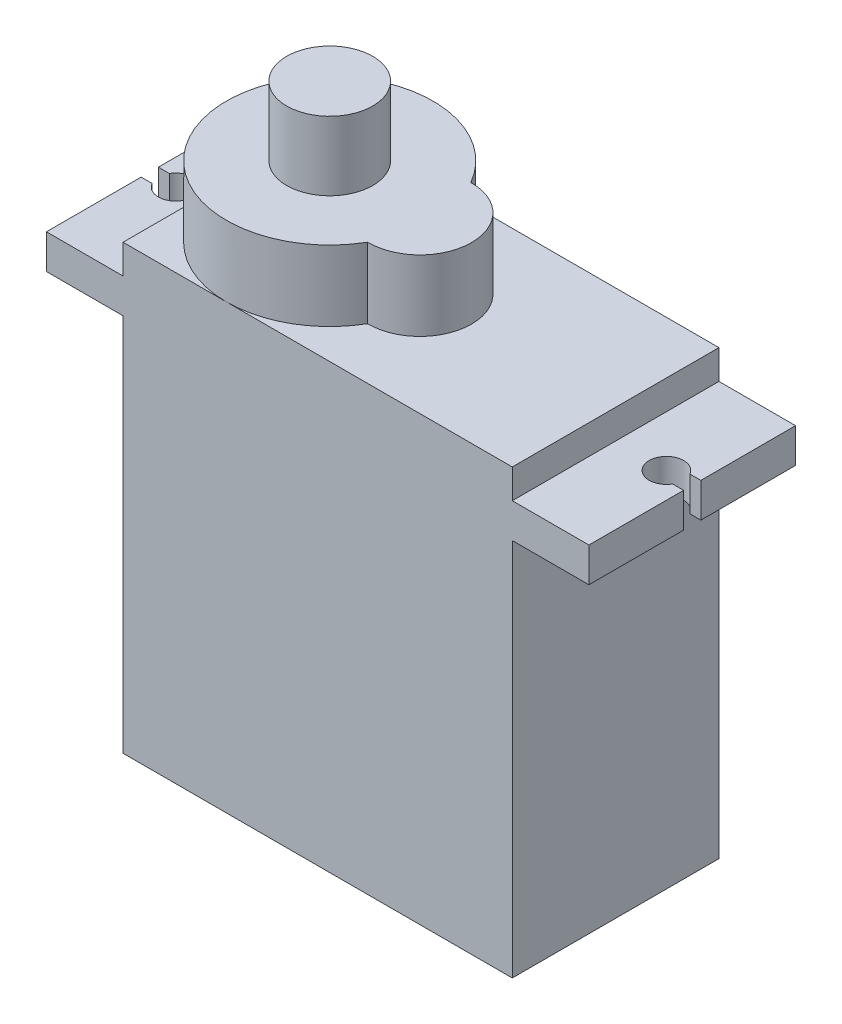
from build123d import *

# Parameters (mm, degrees)
SCHIZZO1_W                   = 22.6
SCHIZZO1_H                   = 12
ESTRUSIONE_ESTRUSIONE1_DEPTH = 22
SCHIZZO3_W                   = 31.5
SCHIZZO3_H                   = 12
ESTRUSIONE_ESTRUSIONE2_DEPTH = 2
SCHIZZO4_W                   = 22.6
SCHIZZO4_H                   = 12
ESTRUSIONE_ESTRUSIONE3_DEPTH = 1.7
SCHIZZO5_R                   = 3
SCHIZZO5_R_2                 = 6
ESTRUSIONE_ESTRUSIONE4_DEPTH = 4.1
SCHIZZO6_R                   = 2.5
ESTRUSIONE_ESTRUSIONE5_DEPTH = 4
TAGLIO_ESTRUSIONE2_REACH     = 40.101


with BuildPart() as part:
    # Schizzo1 → Estrusione-Estrusione1 (new body)
    with BuildSketch(Plane(origin=(0, 0, 0), x_dir=(1, 0, 0), z_dir=(0, 1, 0))):
        with Locations((11.3, 6)):
            Rectangle(SCHIZZO1_W, SCHIZZO1_H)
    extrude(amount=ESTRUSIONE_ESTRUSIONE1_DEPTH)

    # Schizzo3 → Estrusione-Estrusione2 (add)
    with BuildSketch(Plane(origin=(0, 22, 0), x_dir=(1, 0, 0), z_dir=(0, 1, 0))):
        with Locations((11.3, 6)):
            Rectangle(SCHIZZO3_W, SCHIZZO3_H)
    extrude(amount=ESTRUSIONE_ESTRUSIONE2_DEPTH)

    # Schizzo4 → Estrusione-Estrusione3 (add)
    with BuildSketch(Plane(origin=(0, 24, 0), x_dir=(1, 0, 0), z_dir=(0, 1, 0))):
        with Locations((11.3, 6)):
            Rectangle(SCHIZZO4_W, SCHIZZO4_H)
    extrude(amount=ESTRUSIONE_ESTRUSIONE3_DEPTH)

    # Schizzo5 → Estrusione-Estrusione4 (add)
    with BuildSketch(Plane(origin=(0, 25.7, 0), x_dir=(1, 0, 0), z_dir=(0, 1, 0))):
        with Locations((11.236395356, 6)):
            Circle(SCHIZZO5_R)
        with Locations((6, 6)):
            Circle(SCHIZZO5_R_2)
    extrude(amount=ESTRUSIONE_ESTRUSIONE4_DEPTH)

    # Schizzo6 → Estrusione-Estrusione5 (add)
    with BuildSketch(Plane(origin=(0, 29.8, 0), x_dir=(1, 0, 0), z_dir=(0, 1, 0))):
        with Locations(Location((6, 6, 0), (0, 0, 270))):
            Circle(SCHIZZO6_R)
    extrude(amount=ESTRUSIONE_ESTRUSIONE5_DEPTH)

    # Schizzo7 → Taglio-Estrusione2 (cut, up to next)
    with BuildSketch(Plane(origin=(0, 24, 0), x_dir=(1, 0, 0), z_dir=(0, 1, 0)), mode=Mode.PRIVATE) as taglio_estrusione2_sk1:
        with BuildLine():
            Line((-4.45, 5.5), (-3.816025404, 5.5))
            ThreePointArc((-3.816025404, 5.5), (-3.915925826, 5.741180955), (-3.95, 6))
            Line((-3.95, 6), (-4.45, 6))
            Line((-4.45, 6), (-4.45, 5.5))
        make_face()
    taglio_estrusione2_tool1 = extrude(taglio_estrusione2_sk1.sketch, amount=-TAGLIO_ESTRUSIONE2_REACH, mode=Mode.PRIVATE) & part.part
    # Schizzo7 → Taglio-Estrusione2 (cut, up to next)
    with BuildSketch(Plane(origin=(0, 24, 0), x_dir=(1, 0, 0), z_dir=(0, 1, 0)), mode=Mode.PRIVATE) as taglio_estrusione2_sk2:
        with BuildLine():
            ThreePointArc((-3.95, 6), (-3.915925826, 6.258819045), (-3.816025404, 6.5))
            Line((-3.816025404, 6.5), (-4.45, 6.5))
            Line((-4.45, 6.5), (-4.45, 6))
            Line((-4.45, 6), (-3.95, 6))
        make_face()
    taglio_estrusione2_tool2 = extrude(taglio_estrusione2_sk2.sketch, amount=-TAGLIO_ESTRUSIONE2_REACH, mode=Mode.PRIVATE) & part.part
    # Schizzo7 → Taglio-Estrusione2 (cut, up to next)
    with BuildSketch(Plane(origin=(0, 24, 0), x_dir=(1, 0, 0), z_dir=(0, 1, 0)), mode=Mode.PRIVATE) as taglio_estrusione2_sk3:
        with BuildLine():
            ThreePointArc((-3.816025404, 5.5), (-2.691180955, 5.034074174), (-1.95, 6))
            Line((-1.95, 6), (-2.449082486, 6))
            Line((-2.449082486, 6), (-2.449082486, 5.5))
            Line((-2.449082486, 5.5), (-3.816025404, 5.5))
        make_face()
    taglio_estrusione2_tool3 = extrude(taglio_estrusione2_sk3.sketch, amount=-TAGLIO_ESTRUSIONE2_REACH, mode=Mode.PRIVATE) & part.part
    # Schizzo7 → Taglio-Estrusione2 (cut, up to next)
    with BuildSketch(Plane(origin=(0, 24, 0), x_dir=(1, 0, 0), z_dir=(0, 1, 0)), mode=Mode.PRIVATE) as taglio_estrusione2_sk4:
        with BuildLine():
            Line((-2.449082486, 5.5), (-2.449082486, 6))
            Line((-2.449082486, 6), (-3.95, 6))
            ThreePointArc((-3.95, 6), (-3.915925826, 5.741180955), (-3.816025404, 5.5))
            Line((-3.816025404, 5.5), (-2.449082486, 5.5))
        make_face()
    taglio_estrusione2_tool4 = extrude(taglio_estrusione2_sk4.sketch, amount=-TAGLIO_ESTRUSIONE2_REACH, mode=Mode.PRIVATE) & part.part
    # Schizzo7 → Taglio-Estrusione2 (cut, up to next)
    with BuildSketch(Plane(origin=(0, 24, 0), x_dir=(1, 0, 0), z_dir=(0, 1, 0)), mode=Mode.PRIVATE) as taglio_estrusione2_sk5:
        with BuildLine():
            Line((-2.449082486, 6), (-1.95, 6))
            ThreePointArc((-1.95, 6), (-2.691180955, 6.965925826), (-3.816025404, 6.5))
            Line((-3.816025404, 6.5), (-2.449082486, 6.5))
            Line((-2.449082486, 6.5), (-2.449082486, 6))
        make_face()
    taglio_estrusione2_tool5 = extrude(taglio_estrusione2_sk5.sketch, amount=-TAGLIO_ESTRUSIONE2_REACH, mode=Mode.PRIVATE) & part.part
    # Schizzo7 → Taglio-Estrusione2 (cut, up to next)
    with BuildSketch(Plane(origin=(0, 24, 0), x_dir=(1, 0, 0), z_dir=(0, 1, 0)), mode=Mode.PRIVATE) as taglio_estrusione2_sk6:
        with BuildLine():
            Line((-3.95, 6), (-2.449082486, 6))
            Line((-2.449082486, 6), (-2.449082486, 6.5))
            Line((-2.449082486, 6.5), (-3.816025404, 6.5))
            ThreePointArc((-3.816025404, 6.5), (-3.915925826, 6.258819045), (-3.95, 6))
        make_face()
    taglio_estrusione2_tool6 = extrude(taglio_estrusione2_sk6.sketch, amount=-TAGLIO_ESTRUSIONE2_REACH, mode=Mode.PRIVATE) & part.part
    # Schizzo7 → Taglio-Estrusione2 (cut, up to next)
    with BuildSketch(Plane(origin=(0, 24, 0), x_dir=(1, 0, 0), z_dir=(0, 1, 0)), mode=Mode.PRIVATE) as taglio_estrusione2_sk7:
        with BuildLine():
            ThreePointArc((-3.816025404, 5.5), (-2.691180955, 5.034074174), (-1.95, 6))
            Line((-1.95, 6), (-2.449082486, 6))
            Line((-2.449082486, 6), (-2.449082486, 5.5))
            Line((-2.449082486, 5.5), (-3.816025404, 5.5))
        make_face()
    taglio_estrusione2_tool7 = extrude(taglio_estrusione2_sk7.sketch, amount=-TAGLIO_ESTRUSIONE2_REACH, mode=Mode.PRIVATE) & part.part
    # Schizzo7 → Taglio-Estrusione2 (cut, up to next)
    with BuildSketch(Plane(origin=(0, 24, 0), x_dir=(1, 0, 0), z_dir=(0, 1, 0)), mode=Mode.PRIVATE) as taglio_estrusione2_sk8:
        with BuildLine():
            Line((-2.449082486, 5.5), (-2.449082486, 6))
            Line((-2.449082486, 6), (-3.95, 6))
            ThreePointArc((-3.95, 6), (-3.915925826, 5.741180955), (-3.816025404, 5.5))
            Line((-3.816025404, 5.5), (-2.449082486, 5.5))
        make_face()
    taglio_estrusione2_tool8 = extrude(taglio_estrusione2_sk8.sketch, amount=-TAGLIO_ESTRUSIONE2_REACH, mode=Mode.PRIVATE) & part.part
    # Schizzo7 → Taglio-Estrusione2 (cut, up to next)
    with BuildSketch(Plane(origin=(0, 24, 0), x_dir=(1, 0, 0), z_dir=(0, 1, 0)), mode=Mode.PRIVATE) as taglio_estrusione2_sk9:
        with BuildLine():
            Line((-2.449082486, 6), (-1.95, 6))
            ThreePointArc((-1.95, 6), (-2.691180955, 6.965925826), (-3.816025404, 6.5))
            Line((-3.816025404, 6.5), (-2.449082486, 6.5))
            Line((-2.449082486, 6.5), (-2.449082486, 6))
        make_face()
    taglio_estrusione2_tool9 = extrude(taglio_estrusione2_sk9.sketch, amount=-TAGLIO_ESTRUSIONE2_REACH, mode=Mode.PRIVATE) & part.part
    # Schizzo7 → Taglio-Estrusione2 (cut, up to next)
    with BuildSketch(Plane(origin=(0, 24, 0), x_dir=(1, 0, 0), z_dir=(0, 1, 0)), mode=Mode.PRIVATE) as taglio_estrusione2_sk10:
        with BuildLine():
            Line((-3.95, 6), (-2.449082486, 6))
            Line((-2.449082486, 6), (-2.449082486, 6.5))
            Line((-2.449082486, 6.5), (-3.816025404, 6.5))
            ThreePointArc((-3.816025404, 6.5), (-3.915925826, 6.258819045), (-3.95, 6))
        make_face()
    taglio_estrusione2_tool10 = extrude(taglio_estrusione2_sk10.sketch, amount=-TAGLIO_ESTRUSIONE2_REACH, mode=Mode.PRIVATE) & part.part
    # Schizzo7 → Taglio-Estrusione2 (cut, up to next)
    with BuildSketch(Plane(origin=(0, 24, 0), x_dir=(1, 0, 0), z_dir=(0, 1, 0)), mode=Mode.PRIVATE) as taglio_estrusione2_sk11:
        with BuildLine():
            ThreePointArc((26.416025404, 5.5), (26.515925826, 5.741180955), (26.55, 6))
            Line((26.55, 6), (25.047557224, 6))
            Line((25.047557224, 6), (25.047557224, 5.5))
            Line((25.047557224, 5.5), (26.416025404, 5.5))
        make_face()
    taglio_estrusione2_tool11 = extrude(taglio_estrusione2_sk11.sketch, amount=-TAGLIO_ESTRUSIONE2_REACH, mode=Mode.PRIVATE) & part.part
    # Schizzo7 → Taglio-Estrusione2 (cut, up to next)
    with BuildSketch(Plane(origin=(0, 24, 0), x_dir=(1, 0, 0), z_dir=(0, 1, 0)), mode=Mode.PRIVATE) as taglio_estrusione2_sk12:
        with BuildLine():
            Line((25.047557224, 5.5), (25.047557224, 6))
            Line((25.047557224, 6), (24.55, 6))
            ThreePointArc((24.55, 6), (25.291180955, 5.034074174), (26.416025404, 5.5))
            Line((26.416025404, 5.5), (25.047557224, 5.5))
        make_face()
    taglio_estrusione2_tool12 = extrude(taglio_estrusione2_sk12.sketch, amount=-TAGLIO_ESTRUSIONE2_REACH, mode=Mode.PRIVATE) & part.part
    # Schizzo7 → Taglio-Estrusione2 (cut, up to next)
    with BuildSketch(Plane(origin=(0, 24, 0), x_dir=(1, 0, 0), z_dir=(0, 1, 0)), mode=Mode.PRIVATE) as taglio_estrusione2_sk13:
        with BuildLine():
            ThreePointArc((26.416025404, 5.5), (26.515925826, 5.741180955), (26.55, 6))
            Line((26.55, 6), (25.047557224, 6))
            Line((25.047557224, 6), (25.047557224, 5.5))
            Line((25.047557224, 5.5), (26.416025404, 5.5))
        make_face()
    taglio_estrusione2_tool13 = extrude(taglio_estrusione2_sk13.sketch, amount=-TAGLIO_ESTRUSIONE2_REACH, mode=Mode.PRIVATE) & part.part
    # Schizzo7 → Taglio-Estrusione2 (cut, up to next)
    with BuildSketch(Plane(origin=(0, 24, 0), x_dir=(1, 0, 0), z_dir=(0, 1, 0)), mode=Mode.PRIVATE) as taglio_estrusione2_sk14:
        with BuildLine():
            Line((25.047557224, 5.5), (25.047557224, 6))
            Line((25.047557224, 6), (24.55, 6))
            ThreePointArc((24.55, 6), (25.291180955, 5.034074174), (26.416025404, 5.5))
            Line((26.416025404, 5.5), (25.047557224, 5.5))
        make_face()
    taglio_estrusione2_tool14 = extrude(taglio_estrusione2_sk14.sketch, amount=-TAGLIO_ESTRUSIONE2_REACH, mode=Mode.PRIVATE) & part.part
    # Schizzo7 → Taglio-Estrusione2 (cut, up to next)
    with BuildSketch(Plane(origin=(0, 24, 0), x_dir=(1, 0, 0), z_dir=(0, 1, 0)), mode=Mode.PRIVATE) as taglio_estrusione2_sk15:
        with BuildLine():
            Line((25.047557224, 6), (26.55, 6))
            ThreePointArc((26.55, 6), (26.515925826, 6.258819045), (26.416025404, 6.5))
            Line((26.416025404, 6.5), (25.047557224, 6.5))
            Line((25.047557224, 6.5), (25.047557224, 6))
        make_face()
    taglio_estrusione2_tool15 = extrude(taglio_estrusione2_sk15.sketch, amount=-TAGLIO_ESTRUSIONE2_REACH, mode=Mode.PRIVATE) & part.part
    # Schizzo7 → Taglio-Estrusione2 (cut, up to next)
    with BuildSketch(Plane(origin=(0, 24, 0), x_dir=(1, 0, 0), z_dir=(0, 1, 0)), mode=Mode.PRIVATE) as taglio_estrusione2_sk16:
        with BuildLine():
            Line((24.55, 6), (25.047557224, 6))
            Line((25.047557224, 6), (25.047557224, 6.5))
            Line((25.047557224, 6.5), (26.416025404, 6.5))
            ThreePointArc((26.416025404, 6.5), (25.291180955, 6.965925826), (24.55, 6))
        make_face()
    taglio_estrusione2_tool16 = extrude(taglio_estrusione2_sk16.sketch, amount=-TAGLIO_ESTRUSIONE2_REACH, mode=Mode.PRIVATE) & part.part
    # Schizzo7 → Taglio-Estrusione2 (cut, up to next)
    with BuildSketch(Plane(origin=(0, 24, 0), x_dir=(1, 0, 0), z_dir=(0, 1, 0)), mode=Mode.PRIVATE) as taglio_estrusione2_sk17:
        with BuildLine():
            Line((25.047557224, 6), (26.55, 6))
            ThreePointArc((26.55, 6), (26.515925826, 6.258819045), (26.416025404, 6.5))
            Line((26.416025404, 6.5), (25.047557224, 6.5))
            Line((25.047557224, 6.5), (25.047557224, 6))
        make_face()
    taglio_estrusione2_tool17 = extrude(taglio_estrusione2_sk17.sketch, amount=-TAGLIO_ESTRUSIONE2_REACH, mode=Mode.PRIVATE) & part.part
    # Schizzo7 → Taglio-Estrusione2 (cut, up to next)
    with BuildSketch(Plane(origin=(0, 24, 0), x_dir=(1, 0, 0), z_dir=(0, 1, 0)), mode=Mode.PRIVATE) as taglio_estrusione2_sk18:
        with BuildLine():
            Line((24.55, 6), (25.047557224, 6))
            Line((25.047557224, 6), (25.047557224, 6.5))
            Line((25.047557224, 6.5), (26.416025404, 6.5))
            ThreePointArc((26.416025404, 6.5), (25.291180955, 6.965925826), (24.55, 6))
        make_face()
    taglio_estrusione2_tool18 = extrude(taglio_estrusione2_sk18.sketch, amount=-TAGLIO_ESTRUSIONE2_REACH, mode=Mode.PRIVATE) & part.part
    # Schizzo7 → Taglio-Estrusione2 (cut, up to next)
    with BuildSketch(Plane(origin=(0, 24, 0), x_dir=(1, 0, 0), z_dir=(0, 1, 0)), mode=Mode.PRIVATE) as taglio_estrusione2_sk19:
        with BuildLine():
            Line((26.55, 6), (27.05, 6))
            Line((27.05, 6), (27.05, 6.5))
            Line((27.05, 6.5), (26.416025404, 6.5))
            ThreePointArc((26.416025404, 6.5), (26.515925826, 6.258819045), (26.55, 6))
        make_face()
    taglio_estrusione2_tool19 = extrude(taglio_estrusione2_sk19.sketch, amount=-TAGLIO_ESTRUSIONE2_REACH, mode=Mode.PRIVATE) & part.part
    # Schizzo7 → Taglio-Estrusione2 (cut, up to next)
    with BuildSketch(Plane(origin=(0, 24, 0), x_dir=(1, 0, 0), z_dir=(0, 1, 0)), mode=Mode.PRIVATE) as taglio_estrusione2_sk20:
        with BuildLine():
            Line((27.05, 5.5), (27.05, 6))
            Line((27.05, 6), (26.55, 6))
            ThreePointArc((26.55, 6), (26.515925826, 5.741180955), (26.416025404, 5.5))
            Line((26.416025404, 5.5), (27.05, 5.5))
        make_face()
    taglio_estrusione2_tool20 = extrude(taglio_estrusione2_sk20.sketch, amount=-TAGLIO_ESTRUSIONE2_REACH, mode=Mode.PRIVATE) & part.part
    add(taglio_estrusione2_tool1.solids().sort_by_distance((-4.176869, 24, -5.73988))[0], mode=Mode.SUBTRACT)
    add(taglio_estrusione2_tool2.solids().sort_by_distance((-4.176869, 24, -6.26012))[0], mode=Mode.SUBTRACT)
    add(taglio_estrusione2_tool3.solids().sort_by_distance((-2.752339, 24, -5.42137))[0], mode=Mode.SUBTRACT)
    add(taglio_estrusione2_tool4.solids().sort_by_distance((-3.178383, 24, -5.753773))[0], mode=Mode.SUBTRACT)
    add(taglio_estrusione2_tool5.solids().sort_by_distance((-2.752339, 24, -6.57863))[0], mode=Mode.SUBTRACT)
    add(taglio_estrusione2_tool6.solids().sort_by_distance((-3.178383, 24, -6.246227))[0], mode=Mode.SUBTRACT)
    add(taglio_estrusione2_tool7.solids().sort_by_distance((-2.752339, 24, -5.42137))[0], mode=Mode.SUBTRACT)
    add(taglio_estrusione2_tool8.solids().sort_by_distance((-3.178383, 24, -5.753773))[0], mode=Mode.SUBTRACT)
    add(taglio_estrusione2_tool9.solids().sort_by_distance((-2.752339, 24, -6.57863))[0], mode=Mode.SUBTRACT)
    add(taglio_estrusione2_tool10.solids().sort_by_distance((-3.178383, 24, -6.246227))[0], mode=Mode.SUBTRACT)
    add(taglio_estrusione2_tool11.solids().sort_by_distance((25.777619, 24, -5.753769))[0], mode=Mode.SUBTRACT)
    add(taglio_estrusione2_tool12.solids().sort_by_distance((25.352614, 24, -5.421072))[0], mode=Mode.SUBTRACT)
    add(taglio_estrusione2_tool13.solids().sort_by_distance((25.777619, 24, -5.753769))[0], mode=Mode.SUBTRACT)
    add(taglio_estrusione2_tool14.solids().sort_by_distance((25.352614, 24, -5.421072))[0], mode=Mode.SUBTRACT)
    add(taglio_estrusione2_tool15.solids().sort_by_distance((25.777619, 24, -6.246231))[0], mode=Mode.SUBTRACT)
    add(taglio_estrusione2_tool16.solids().sort_by_distance((25.352614, 24, -6.578928))[0], mode=Mode.SUBTRACT)
    add(taglio_estrusione2_tool17.solids().sort_by_distance((25.777619, 24, -6.246231))[0], mode=Mode.SUBTRACT)
    add(taglio_estrusione2_tool18.solids().sort_by_distance((25.352614, 24, -6.578928))[0], mode=Mode.SUBTRACT)
    add(taglio_estrusione2_tool19.solids().sort_by_distance((26.776869, 24, -6.26012))[0], mode=Mode.SUBTRACT)
    add(taglio_estrusione2_tool20.solids().sort_by_distance((26.776869, 24, -5.73988))[0], mode=Mode.SUBTRACT)


solid = part.part
